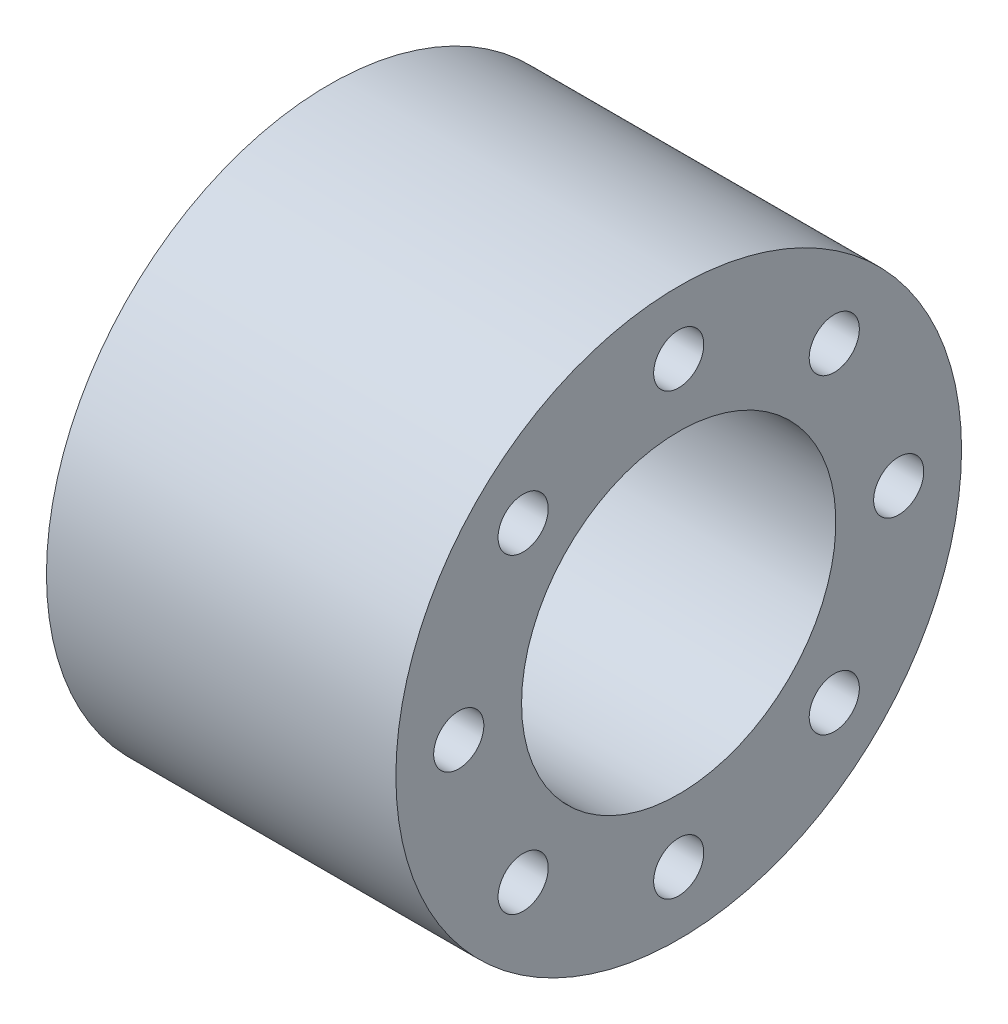
from build123d import *

# Parameters (mm, degrees)
SKETCH1_W                                        = 47.06874
SKETCH1_H                                        = 16.933333333
CBORE_FOR_1_4_SOCKET_HEAD_CAP_SCREW1_D           = 6.7564
CBORE_FOR_1_4_SOCKET_HEAD_CAP_SCREW1_CBORE_D     = 11.1125
CBORE_FOR_1_4_SOCKET_HEAD_CAP_SCREW1_CBORE_DEPTH = 6.35
F_3_16_0_1875_DOWEL_HOLE1_D                      = 4.7625
F_3_16_0_1875_DOWEL_HOLE1_DEPTH                  = 9.652
F_3_16_0_1875_DOWEL_HOLE1_TIP                    = 1.430799349


with BuildPart() as part:
    # Sketch1 → Revolve1 (revolve)
    with BuildSketch(Plane.XY, mode=Mode.PRIVATE) as revolve1_sk:
        with Locations((23.53437, 29.633333334)):
            Rectangle(SKETCH1_W, SKETCH1_H)
    revolve(revolve1_sk.sketch.rotate(Axis((0, 0, 0), (1, 0, 0)), 90), axis=Axis((0, 0, 0), (1, 0, 0)))

    # CBORE for 1/4 Socket Head Cap Screw1 (through all)
    with Locations(Plane.ZY):
        with Locations((0, 29.633333333), (20.953930949, 20.953930949), (29.633333333, 0), (20.953930949, -20.953930949), (0, -29.633333333), (-20.953930949, -20.953930949), (-29.633333333, 0), (-20.953930949, 20.953930949)):
            CounterBoreHole(CBORE_FOR_1_4_SOCKET_HEAD_CAP_SCREW1_D / 2, CBORE_FOR_1_4_SOCKET_HEAD_CAP_SCREW1_CBORE_D / 2, CBORE_FOR_1_4_SOCKET_HEAD_CAP_SCREW1_CBORE_DEPTH)

    # 3/16 (0.1875) Dowel Hole1
    with Locations(Plane.ZY):
        with Locations((-11.542689029, 27.866516399), (27.866516399, 11.542689029), (11.542689029, -27.866516399), (-27.866516399, -11.542689029)):
            Hole(F_3_16_0_1875_DOWEL_HOLE1_D / 2, depth=F_3_16_0_1875_DOWEL_HOLE1_DEPTH)
            with Locations((0, 0, -(F_3_16_0_1875_DOWEL_HOLE1_DEPTH + F_3_16_0_1875_DOWEL_HOLE1_TIP / 2))):  # 118° drill point
                Cone(0, F_3_16_0_1875_DOWEL_HOLE1_D / 2, F_3_16_0_1875_DOWEL_HOLE1_TIP, mode=Mode.SUBTRACT)


solid = part.part
